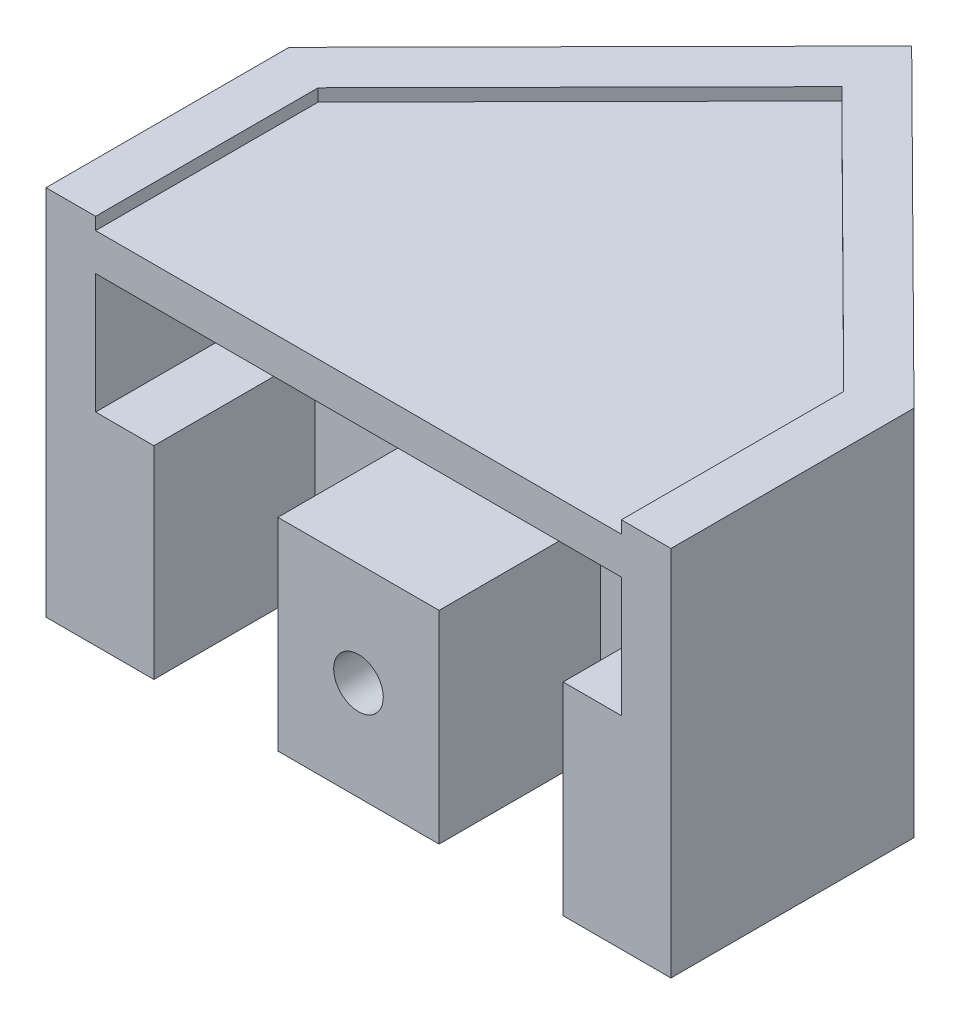
from build123d import *

# Parameters (mm, degrees)
SKETCH2_W           = 25.2
SKETCH2_H           = 15
BOSS_EXTRUDE2_DEPTH = 2
SKETCH3_W           = 2
SKETCH3_H           = 13
BOSS_EXTRUDE3_DEPTH = 7.8
BOSS_EXTRUDE4_DEPTH = 15
SKETCH5_W           = 6.5
SKETCH5_H           = 8.163083502
SKETCH5_W_2         = 2.35
BOSS_EXTRUDE5_DEPTH = 7.8
SKETCH6_W           = 5
SKETCH6_H           = 8.163083502
BOSS_EXTRUDE6_DEPTH = 1.3
SKETCH8_W           = 21.2
SKETCH8_H           = 2
CUT_EXTRUDE1_DEPTH  = 0.5
SKETCH10_R          = 1
CUT_EXTRUDE4_DEPTH  = 6


with BuildPart() as part:
    # Sketch2 → Boss-Extrude2 (new body)
    with BuildSketch(Plane.XY):
        with Locations((-12.6, 7.5)):
            Rectangle(SKETCH2_W, SKETCH2_H)
    extrude(amount=BOSS_EXTRUDE2_DEPTH)

    # Sketch3 → Boss-Extrude3 (add)
    with BuildSketch(Plane.XY.offset(2)):
        Polygon((-25.2, 15), (-25.2, 0), (-23.2, 0), (-23.2, 13), (-23.2, 15), align=None)
        Polygon((-23.2, 15), (-23.2, 13), (-2, 13), (0, 13), (0, 15), align=None)
        with Locations((-1, 6.5)):
            Rectangle(SKETCH3_W, SKETCH3_H)
    extrude(amount=BOSS_EXTRUDE3_DEPTH)

    # Sketch4 → Boss-Extrude4 (add, through all)
    with BuildSketch(Plane(origin=(0, 15, 0), x_dir=(1, 0, 0), z_dir=(0, 1, 0))):
        Polygon((0, 0), (-12.693339498, 12.599654271), (-25.2, 0), align=None)
    extrude(amount=-BOSS_EXTRUDE4_DEPTH)

    # Sketch5 → Boss-Extrude5 (add)
    with BuildSketch(Plane.XY.offset(2)):
        with Locations((-12.6, 4.081541751)):
            Rectangle(SKETCH5_W, SKETCH5_H)
        with Locations((-3.175, 4.081541751)):
            Rectangle(SKETCH5_W_2, SKETCH5_H)
        with Locations((-22.025, 4.081541751)):
            Rectangle(SKETCH5_W_2, SKETCH5_H)
    extrude(amount=BOSS_EXTRUDE5_DEPTH)

    # Sketch6 → Boss-Extrude6 (add)
    with BuildSketch(Plane.XY.offset(2)):
        with Locations((-18.35, 4.081541751)):
            Rectangle(SKETCH6_W, SKETCH6_H)
        with Locations((-6.85, 4.081541751)):
            Rectangle(SKETCH6_W, SKETCH6_H)
    extrude(amount=BOSS_EXTRUDE6_DEPTH)

    # Sketch8 → Cut-Extrude1 (cut)
    with BuildSketch(Plane(origin=(0, 15, 0), x_dir=(1, 0, 0), z_dir=(0, 1, 0))):
        Polygon((-12.682863078, 9.771246548), (-23.2, -0.824090961), (-23.2, -7.8), (-2, -7.8), (-2, -0.832769946), align=None)
        with Locations((-12.6, -8.8)):
            Rectangle(SKETCH8_W, SKETCH8_H)
    extrude(amount=-CUT_EXTRUDE1_DEPTH, mode=Mode.SUBTRACT)

    # Sketch10 → Cut-Extrude4 (cut)
    with BuildSketch(Plane.XY.offset(9.8)):
        with Locations((-12.6, 4)):
            Circle(SKETCH10_R)
    extrude(amount=-CUT_EXTRUDE4_DEPTH, mode=Mode.SUBTRACT)


solid = part.part
